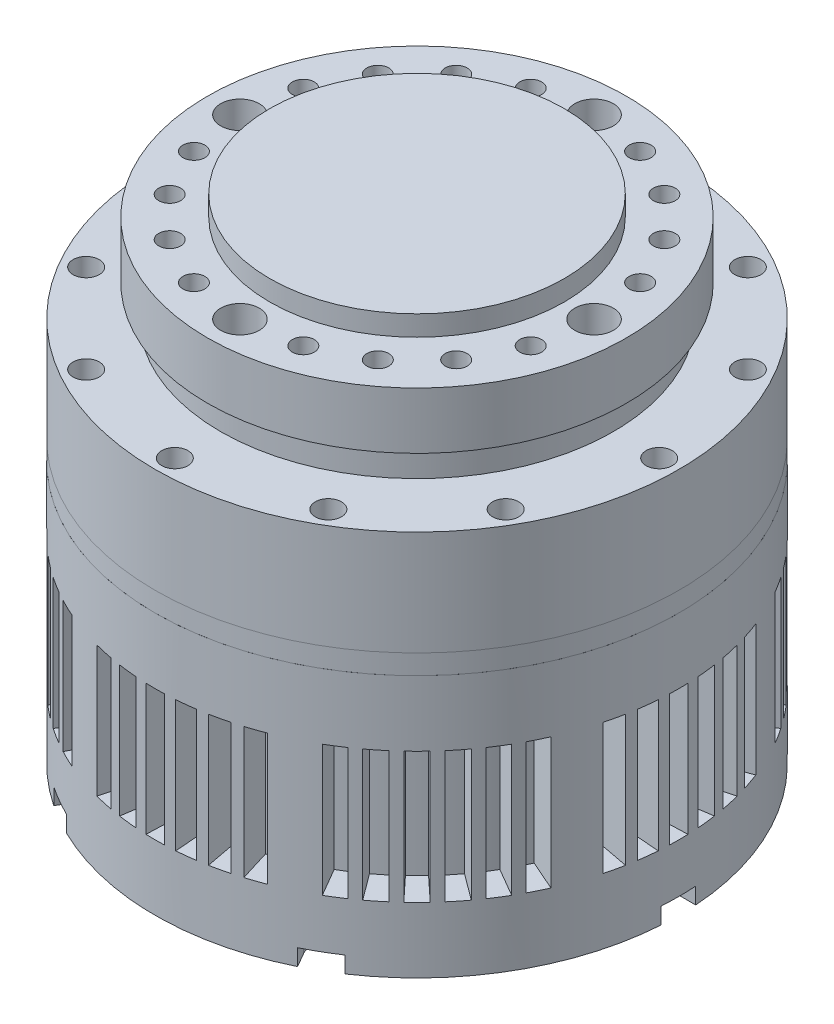
from build123d import *

# Parameters (mm, degrees)
SKETCH1_R           = 40
BOSS_EXTRUDE1_DEPTH = 16
SKETCH2_R           = 2
CUT_EXTRUDE1_DEPTH  = 5
CIRPATTERN1_COUNT   = 12
SKETCH3_R           = 40
BOSS_EXTRUDE2_DEPTH = 3
SKETCH4_R           = 40
BOSS_EXTRUDE3_DEPTH = 40
SKETCH6_R           = 30
BOSS_EXTRUDE4_DEPTH = 4.75
SKETCH8_R           = 32
BOSS_EXTRUDE5_DEPTH = 8.65
SKETCH9_R           = 22.5
BOSS_EXTRUDE6_DEPTH = 3.1
SKETCH10_R          = 2.95
CUT_EXTRUDE5_DEPTH  = 7
CIRPATTERN3_COUNT   = 4
SKETCH14_R          = 1.675
CUT_EXTRUDE6_DEPTH  = 7
CIRPATTERN4_COUNT   = 20
CUT_EXTRUDE8_DEPTH  = 2.5
CIRPATTERN5_COUNT   = 6
CUT_EXTRUDE9_START  = -10
CUT_EXTRUDE9_DEPTH  = 20
CIRPATTERN6_COUNT   = 8


with BuildPart() as part:
    # Sketch1 → Boss-Extrude1 (new body)
    with BuildSketch(Plane(origin=(0, 0, 0), x_dir=(1, 0, 0), z_dir=(0, 1, 0))):
        with Locations(Location((0, 0, 0), (0, 0, 270))):
            Circle(SKETCH1_R)
    extrude(amount=BOSS_EXTRUDE1_DEPTH)

    # Sketch2 → Cut-Extrude1 (cut)
    with BuildSketch(Plane(origin=(0, 16, 0), x_dir=(1, 0, 0), z_dir=(0, 1, 0))):
        with Locations(Location((0, 37, 0), (0, 0, 270))):
            Circle(SKETCH2_R)
    cut_extrude1 = extrude(amount=-CUT_EXTRUDE1_DEPTH, mode=Mode.SUBTRACT)

    # CirPattern1: Cut-Extrude1 ×12 about axis
    cirpattern1_axis = Axis((0, 0, 0), (0, 1, 0))
    for i in range(1, CIRPATTERN1_COUNT):
        add(cut_extrude1.rotate(cirpattern1_axis, i * 360 / CIRPATTERN1_COUNT), mode=Mode.SUBTRACT)


with BuildPart() as body_2:
    # Sketch3 → Boss-Extrude2 (new body)
    with BuildSketch(Plane.XZ):
        with Locations(Location((0, 0, 0), (0, 0, 270))):
            Circle(SKETCH3_R)
    extrude(amount=BOSS_EXTRUDE2_DEPTH)


with BuildPart() as body_3:
    # Sketch4 → Boss-Extrude3 (new body)
    with BuildSketch(Plane.XZ.offset(3)):
        with Locations(Location((0, 0, 0), (0, 0, 270))):
            Circle(SKETCH4_R)
    extrude(amount=BOSS_EXTRUDE3_DEPTH)

    # Sketch16 → Cut-Extrude8 (cut)
    with BuildSketch(Plane.XZ.offset(43)):
        with BuildLine():
            Line((20.976067743, 30.998281741), (22.26490714, 33.230617058))
            ThreePointArc((22.26490714, 33.230617058), (20, 34.641016151), (17.646104986, 35.897283725))
            Line((17.646104986, 35.897283725), (16.35726559, 33.664948408))
            ThreePointArc((16.35726559, 33.664948408), (17.333333333, 30.022213998), (20.976067743, 30.998281741))
        make_face()
    cut_extrude8 = extrude(amount=-CUT_EXTRUDE8_DEPTH, mode=Mode.SUBTRACT)

    # CirPattern5: Cut-Extrude8 ×6 about axis
    cirpattern5_axis = Axis((0, 0, 0), (0, 1, 0))
    for i in range(1, CIRPATTERN5_COUNT):
        add(cut_extrude8.rotate(cirpattern5_axis, i * 360 / CIRPATTERN5_COUNT), mode=Mode.SUBTRACT)

    # Sketch5 → Cut-Extrude9 (cut)
    with BuildSketch(Plane.XZ.offset(43).offset(CUT_EXTRUDE9_START)):
        with BuildLine():
            Line((-10.229664414, 38.669806904), (-8.950956362, 33.836081041))
            ThreePointArc((-8.950956362, 33.836081041), (-7.736814557, 34.134172035), (-6.512801217, 34.388710652))
            Line((-6.512801217, 34.388710652), (-7.443201391, 39.301383602))
            ThreePointArc((-7.443201391, 39.301383602), (-8.842073779, 39.010482326), (-10.229664414, 38.669806904))
        make_face()
        with BuildLine():
            Line((-5.132317687, 34.621659625), (-5.865505928, 39.567610999))
            ThreePointArc((-5.865505928, 39.567610999), (-4.448635014, 39.751850856), (-3.02608801, 39.885370643))
            Line((-3.02608801, 39.885370643), (-2.647827009, 34.899699313))
            ThreePointArc((-2.647827009, 34.899699313), (-3.892555637, 34.782869499), (-5.132317687, 34.621659625))
        make_face()
        with BuildLine():
            Line((-1.428571429, 39.974481656), (-1.25, 34.977671449))
            ThreePointArc((-1.25, 34.977671449), (0, 35), (1.25, 34.977671449))
            Line((1.25, 34.977671449), (1.428571429, 39.974481656))
            ThreePointArc((1.428571429, 39.974481656), (0, 40), (-1.428571429, 39.974481656))
        make_face()
        with BuildLine():
            Line((2.647827009, 34.899699313), (3.02608801, 39.885370643))
            ThreePointArc((3.02608801, 39.885370643), (4.448635014, 39.751850856), (5.865505928, 39.567610999))
            Line((5.865505928, 39.567610999), (5.132317687, 34.621659625))
            ThreePointArc((5.132317687, 34.621659625), (3.892555637, 34.782869499), (2.647827009, 34.899699313))
        make_face()
        with BuildLine():
            Line((7.443201391, 39.301383602), (6.512801217, 34.388710652))
            ThreePointArc((6.512801217, 34.388710652), (7.736814557, 34.134172035), (8.950956362, 33.836081041))
            Line((8.950956362, 33.836081041), (10.229664414, 38.669806904))
            ThreePointArc((10.229664414, 38.669806904), (8.842073779, 39.010482326), (7.443201391, 39.301383602))
        make_face()
        with BuildLine():
            Line((14.466898777, 37.292208835), (12.65853643, 32.63068273))
            ThreePointArc((12.65853643, 32.63068273), (11.485079282, 33.061956293), (10.296968123, 33.451045536))
            Line((10.296968123, 33.451045536), (11.767963569, 38.229766327))
            ThreePointArc((11.767963569, 38.229766327), (13.125804893, 37.785092906), (14.466898777, 37.292208835))
        make_face()
    cut_extrude9 = extrude(amount=-CUT_EXTRUDE9_DEPTH, mode=Mode.SUBTRACT)

    # CirPattern6: Cut-Extrude9 ×8 about axis
    cirpattern6_axis = Axis((0, 0, 0), (0, 1, 0))
    for i in range(1, CIRPATTERN6_COUNT):
        add(cut_extrude9.rotate(cirpattern6_axis, i * 360 / CIRPATTERN6_COUNT), mode=Mode.SUBTRACT)


with BuildPart() as body_4:
    # Sketch6 → Boss-Extrude4 (new body)
    with BuildSketch(Plane(origin=(0, 16, 0), x_dir=(1, 0, 0), z_dir=(0, 1, 0))):
        with Locations(Location((0, 0, 0), (0, 0, 270))):
            Circle(SKETCH6_R)
    extrude(amount=BOSS_EXTRUDE4_DEPTH)


with BuildPart() as body_5:
    # Sketch8 → Boss-Extrude5 (new body)
    with BuildSketch(Plane(origin=(0, 20.75, 0), x_dir=(1, 0, 0), z_dir=(0, 1, 0))):
        with Locations(Location((0, 0, 0), (0, 0, 270))):
            Circle(SKETCH8_R)
    extrude(amount=BOSS_EXTRUDE5_DEPTH)

    # Sketch9 → Boss-Extrude6 (add)
    with BuildSketch(Plane(origin=(0, 29.4, 0), x_dir=(1, 0, 0), z_dir=(0, 1, 0))):
        with Locations(Location((0, 0, 0), (0, 0, 90))):
            Circle(SKETCH9_R)
    extrude(amount=BOSS_EXTRUDE6_DEPTH)

    # Sketch10 → Cut-Extrude5 (cut)
    with BuildSketch(Plane(origin=(0, 29.4, 0), x_dir=(1, 0, 0), z_dir=(0, 1, 0))):
        with Locations(Location((0, 27.05, 0), (0, 0, 270))):
            Circle(SKETCH10_R)
    cut_extrude5 = extrude(amount=-CUT_EXTRUDE5_DEPTH, mode=Mode.SUBTRACT)

    # CirPattern3: Cut-Extrude5 ×4 about axis
    cirpattern3_axis = Axis((0, 0, 0), (0, 1, 0))
    for i in range(1, CIRPATTERN3_COUNT):
        add(cut_extrude5.rotate(cirpattern3_axis, i * 360 / CIRPATTERN3_COUNT), mode=Mode.SUBTRACT)

    # Sketch14 → Cut-Extrude6 (cut)
    with BuildSketch(Plane(origin=(0, 29.4, 0), x_dir=(1, 0, 0), z_dir=(0, 1, 0))):
        with Locations(Location((25.726078766, 8.358909698, 0), (0, 0, 270))):
            Circle(SKETCH14_R)
    cut_extrude6 = extrude(amount=-CUT_EXTRUDE6_DEPTH, mode=Mode.SUBTRACT)

    # CirPattern4: Cut-Extrude6 ×20 about axis, 4 skipped
    cirpattern4_axis = Axis((0, 0, 0), (0, 1, 0))
    add([cut_extrude6.rotate(cirpattern4_axis, i * 360 / CIRPATTERN4_COUNT) for i in range(1, CIRPATTERN4_COUNT) if i not in (4, 9, 14, 19)], mode=Mode.SUBTRACT)


solid = Compound([part.part, body_2.part, body_3.part, body_4.part, body_5.part])
